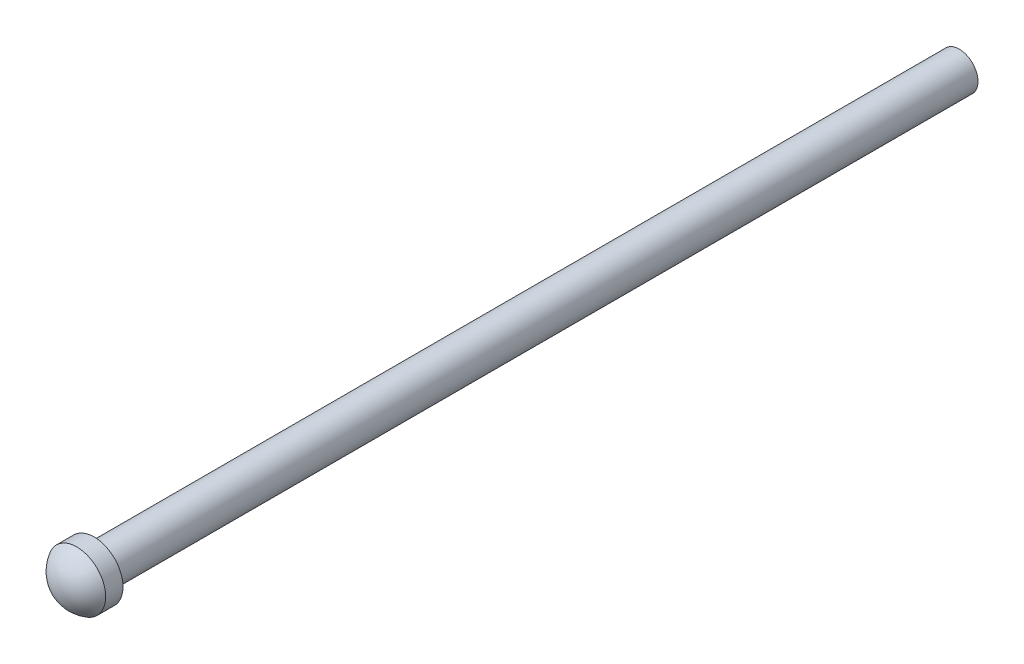
from build123d import *

# Parameters (mm, degrees)
SKETCH1_R           = 3.25
SKETCH3_R           = 5
BOSS_EXTRUDE1_DEPTH = 3
DOME1_FACE_RADIUS   = 5
DOME1_HEIGHT        = 3


with BuildPart() as part:
    # Sweep1: sweep along a path in Sketch2
    with BuildLine(Plane(origin=(0, 0, 0), x_dir=(0, 0, -1), z_dir=(1, 0, 0))) as sweep1_path:
        Line((0, 0), (150, 0))
    # Sketch1 → Sweep1 (sweep)
    with BuildSketch(Plane.XY):
        with Locations((5, 60)):
            Circle(SKETCH1_R)
    sweep(path=sweep1_path.line)

    # Sketch3 → Boss-Extrude1 (add)
    with BuildSketch(Plane.XY):
        with Locations((5, 60)):
            Circle(SKETCH3_R)
    extrude(amount=BOSS_EXTRUDE1_DEPTH)

    # Dome1: a dome of height H over a round flat face of radius A is a cap of a sphere of radius (A * A + H * H) / (2 * H)
    dome1_r = (DOME1_FACE_RADIUS * DOME1_FACE_RADIUS + DOME1_HEIGHT * DOME1_HEIGHT) / (2 * DOME1_HEIGHT)
    dome1_base = Plane((5, 60, 3), z_dir=(0, 0, 1))
    with Locations(dome1_base.offset(DOME1_HEIGHT - dome1_r)):
        dome1_ball = Sphere(dome1_r, mode=Mode.PRIVATE)
    add(split(dome1_ball, bisect_by=dome1_base, keep=Keep.TOP, mode=Mode.PRIVATE))


solid = part.part
